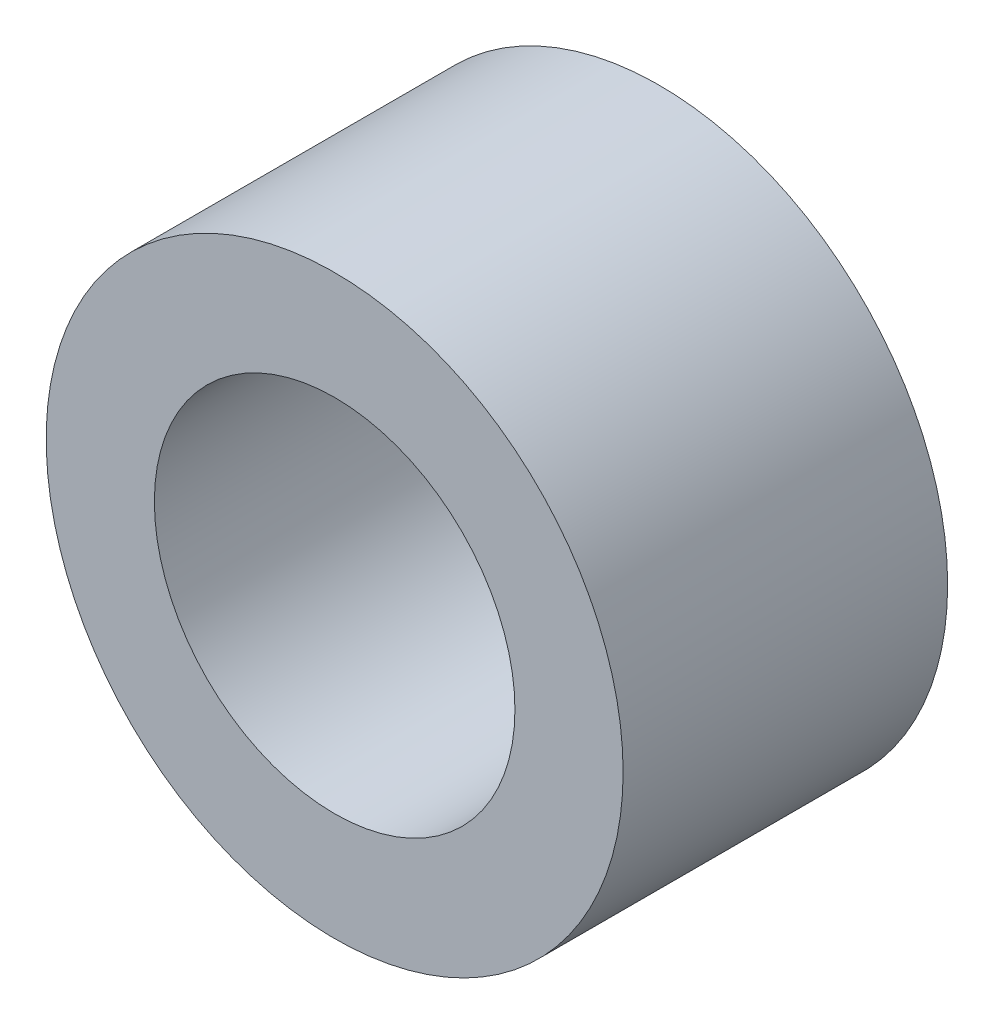
from build123d import *

# Parameters (mm, degrees)
SKETCH_1_R      = 4
SKETCH_1_R_2    = 2.5
EXTRUDE_1_DEPTH = 4.5


with BuildPart() as part:
    # 草图1 → 凸台-拉伸1 (new body)
    with BuildSketch(Plane.XY):
        Circle(SKETCH_1_R)
        Circle(SKETCH_1_R_2, mode=Mode.SUBTRACT)
    extrude(amount=EXTRUDE_1_DEPTH)


solid = part.part
